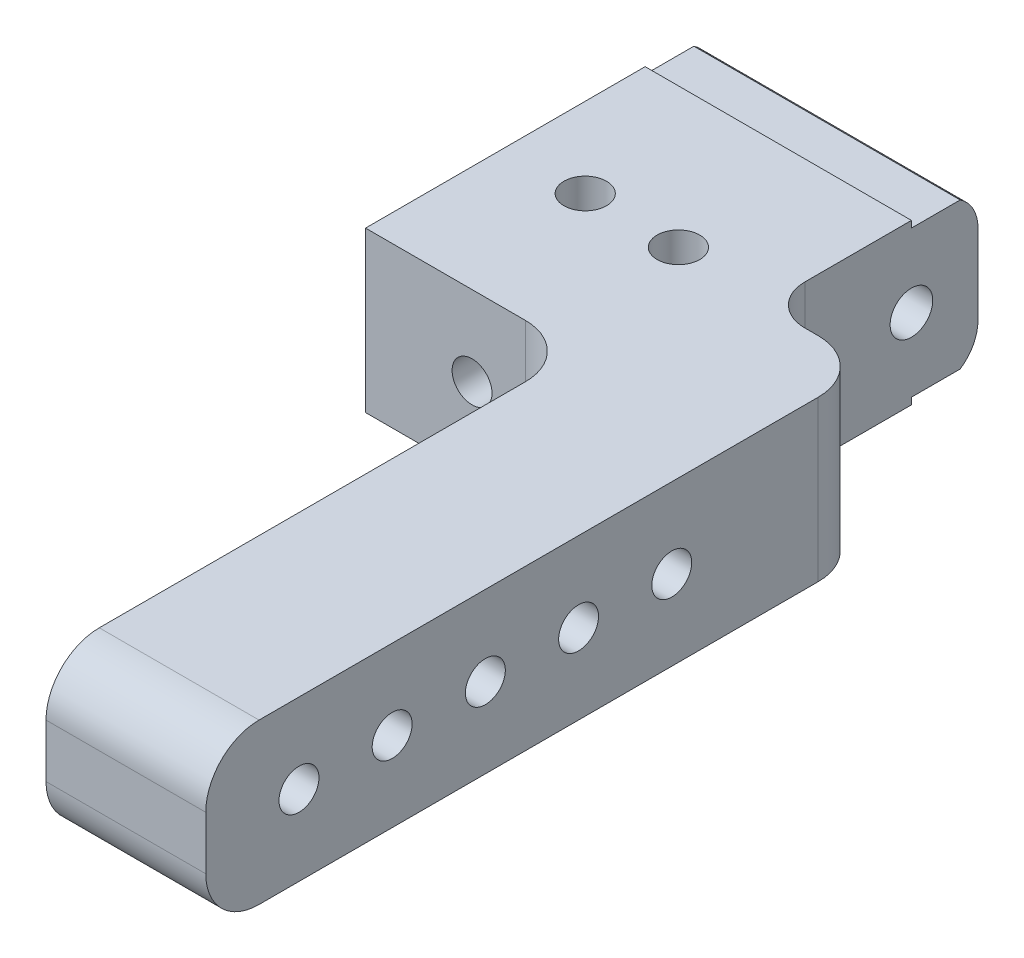
from build123d import *

# Parameters (mm, degrees)
SKETCH1_W           = 20
SKETCH1_H           = 12
BOSS_EXTRUDE1_DEPTH = 26
SKETCH2_W           = 10
SKETCH2_H           = 12
BOSS_EXTRUDE2_DEPTH = 8
SKETCH4_R           = 1.6
CUT_EXTRUDE2_DEPTH  = 41.049968789
FILLET1_R           = 3
FILLET3_R           = 3
SKETCH5_W           = 9.976745634
SKETCH5_H           = 0.5
SKETCH5_W_2         = 12.25993895
CUT_EXTRUDE3_DEPTH  = 41.049968789
SKETCH6_W           = 5.5
SKETCH6_H           = 30.488056323
CUT_EXTRUDE4_DEPTH  = 0.8
SKETCH8_W           = 12
SKETCH8_H           = 12
BOSS_EXTRUDE3_DEPTH = 40
SKETCH3_R           = 1.6
CUT_EXTRUDE1_DEPTH  = 73.691127382
SKETCH9_R           = 1.5
CUT_EXTRUDE6_DEPTH  = 12
FILLET4_R           = 4
SKETCH10_R          = 1.5
CUT_EXTRUDE7_DEPTH  = 12
FILLET5_R           = 4
FILLET7_R           = 4


with BuildPart() as part:
    # Sketch1 → Boss-Extrude1 (new body)
    with BuildSketch(Plane.XY):
        with Locations((10, -6)):
            Rectangle(SKETCH1_W, SKETCH1_H)
    extrude(amount=BOSS_EXTRUDE1_DEPTH)

    # Sketch2 → Boss-Extrude2 (add)
    with BuildSketch(Plane(origin=(20, 0, 0), x_dir=(0, 0, -1), z_dir=(1, 0, 0))):
        with Locations((-21, -6)):
            Rectangle(SKETCH2_W, SKETCH2_H)
    extrude(amount=BOSS_EXTRUDE2_DEPTH)

    # Sketch4 → Cut-Extrude2 (cut, through all)
    with BuildSketch(Plane(origin=(0, 0, 0), x_dir=(1, 0, 0), z_dir=(0, 1, 0))):
        with Locations(Location((13, -15.5, 0), (0, 0, 270))):
            Circle(SKETCH4_R)
        with Locations(Location((6, -15.5, 0), (0, 0, 270))):
            Circle(SKETCH4_R)
    extrude(amount=-CUT_EXTRUDE2_DEPTH, mode=Mode.SUBTRACT)

    # Fillet1
    fillet1_edges = [part.edges().sort_by_distance(p)[0] for p in [
        (20, -6, 16),
    ]]
    fillet(fillet1_edges, radius=FILLET1_R)

    # Fillet3
    fillet3_edges = [part.edges().sort_by_distance(p)[0] for p in [
        (10, 0, 0),
        (10, -12, 0),
    ]]
    fillet(fillet3_edges, radius=FILLET3_R)

    # Sketch5 → Cut-Extrude3 (cut, through all)
    with BuildSketch(Plane.ZY):
        with Locations((0.011627183, -11.75)):
            Rectangle(SKETCH5_W, SKETCH5_H)
        with Locations((-1.129969475, -0.25)):
            Rectangle(SKETCH5_W_2, SKETCH5_H)
    extrude(amount=-CUT_EXTRUDE3_DEPTH, mode=Mode.SUBTRACT)

    # Sketch6 → Cut-Extrude4 (cut)
    with BuildSketch(Plane(origin=(0, 0, 0), x_dir=(-1, 0, 0), z_dir=(0, 0, -1))):
        with Locations((-10, -7.868232937)):
            Rectangle(SKETCH6_W, SKETCH6_H)
    extrude(amount=-CUT_EXTRUDE4_DEPTH, mode=Mode.SUBTRACT)

    # Sketch8 → Boss-Extrude3 (add)
    with BuildSketch(Plane.XY.offset(26)):
        with Locations((22, -6)):
            Rectangle(SKETCH8_W, SKETCH8_H)
    extrude(amount=BOSS_EXTRUDE3_DEPTH)

    # Sketch3 → Cut-Extrude1 (cut, through all)
    with BuildSketch(Plane.ZY):
        with Locations(Location((5, -6, 0), (0, 0, 270))):
            Circle(SKETCH3_R)
    extrude(amount=-CUT_EXTRUDE1_DEPTH, mode=Mode.SUBTRACT)

    # Sketch9 → Cut-Extrude6 (cut)
    with BuildSketch(Plane(origin=(28, 0, 0), x_dir=(0, 0, -1), z_dir=(1, 0, 0))):
        with Locations((-31, -6)):
            Circle(SKETCH9_R)
        with Locations((-38, -6)):
            Circle(SKETCH9_R)
        with Locations((-45, -6)):
            Circle(SKETCH9_R)
        with Locations((-52, -6)):
            Circle(SKETCH9_R)
        with Locations((-59, -6)):
            Circle(SKETCH9_R)
    extrude(amount=-CUT_EXTRUDE6_DEPTH, mode=Mode.SUBTRACT)

    # Fillet4
    fillet4_edges = [part.edges().sort_by_distance(p)[0] for p in [
        (16, -6, 26),
    ]]
    fillet(fillet4_edges, radius=FILLET4_R)

    # Sketch10 → Cut-Extrude7 (cut)
    with BuildSketch(Plane.XY.offset(26)):
        with Locations((8, -6)):
            Circle(SKETCH10_R)
    extrude(amount=-CUT_EXTRUDE7_DEPTH, mode=Mode.SUBTRACT)

    # Fillet5
    fillet5_edges = [part.edges().sort_by_distance(p)[0] for p in [
        (28, -6, 16),
    ]]
    fillet(fillet5_edges, radius=FILLET5_R)

    # Fillet7
    fillet7_edges = [part.edges().sort_by_distance(p)[0] for p in [
        (22, 0, 66),
        (22, -12, 66),
    ]]
    fillet(fillet7_edges, radius=FILLET7_R)


solid = part.part
